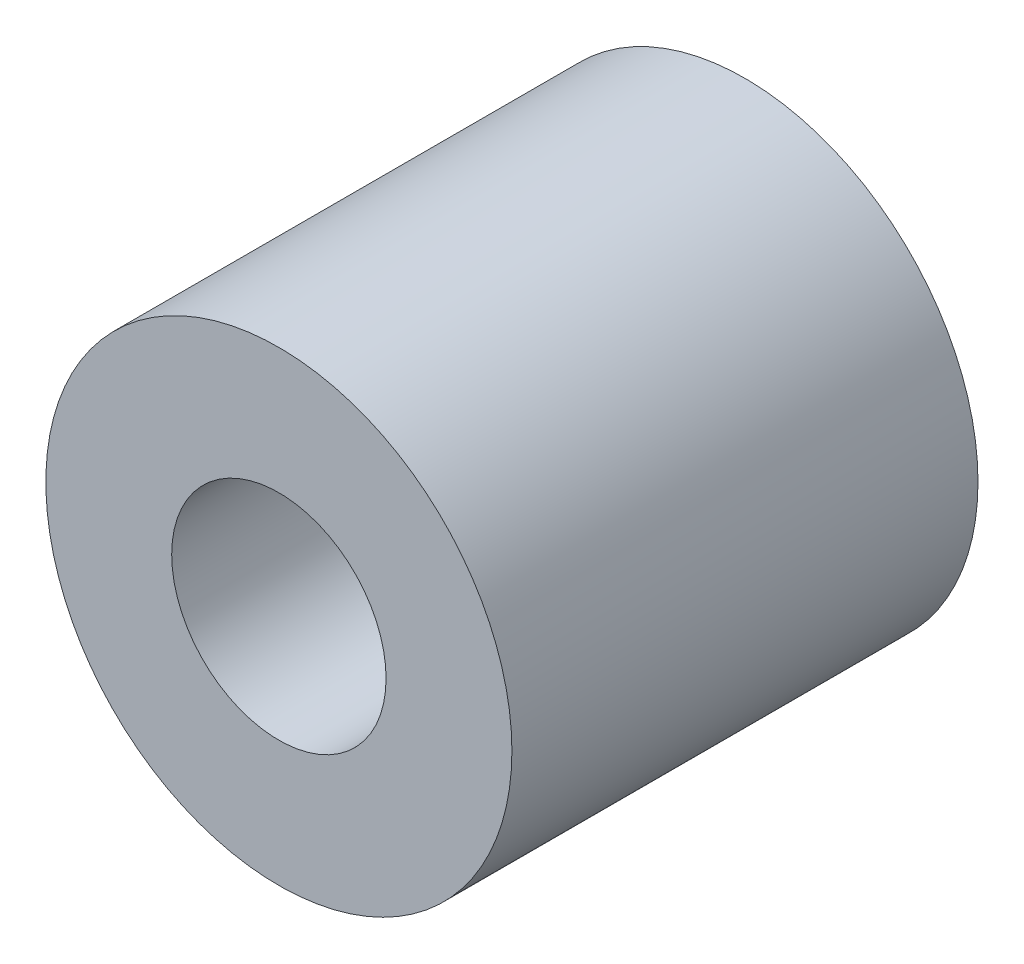
from build123d import *

# Parameters (mm, degrees)
SKETCH1_R      = 3.175
SKETCH1_R_2    = 1.4605
EXTRUDE1_DEPTH = 3.175


with BuildPart() as part:
    # Sketch1 → Extrude1 (new, symmetric)
    with BuildSketch(Plane.XY):
        Circle(SKETCH1_R)
        Circle(SKETCH1_R_2, mode=Mode.SUBTRACT)
    extrude(amount=EXTRUDE1_DEPTH, both=True)


solid = part.part
